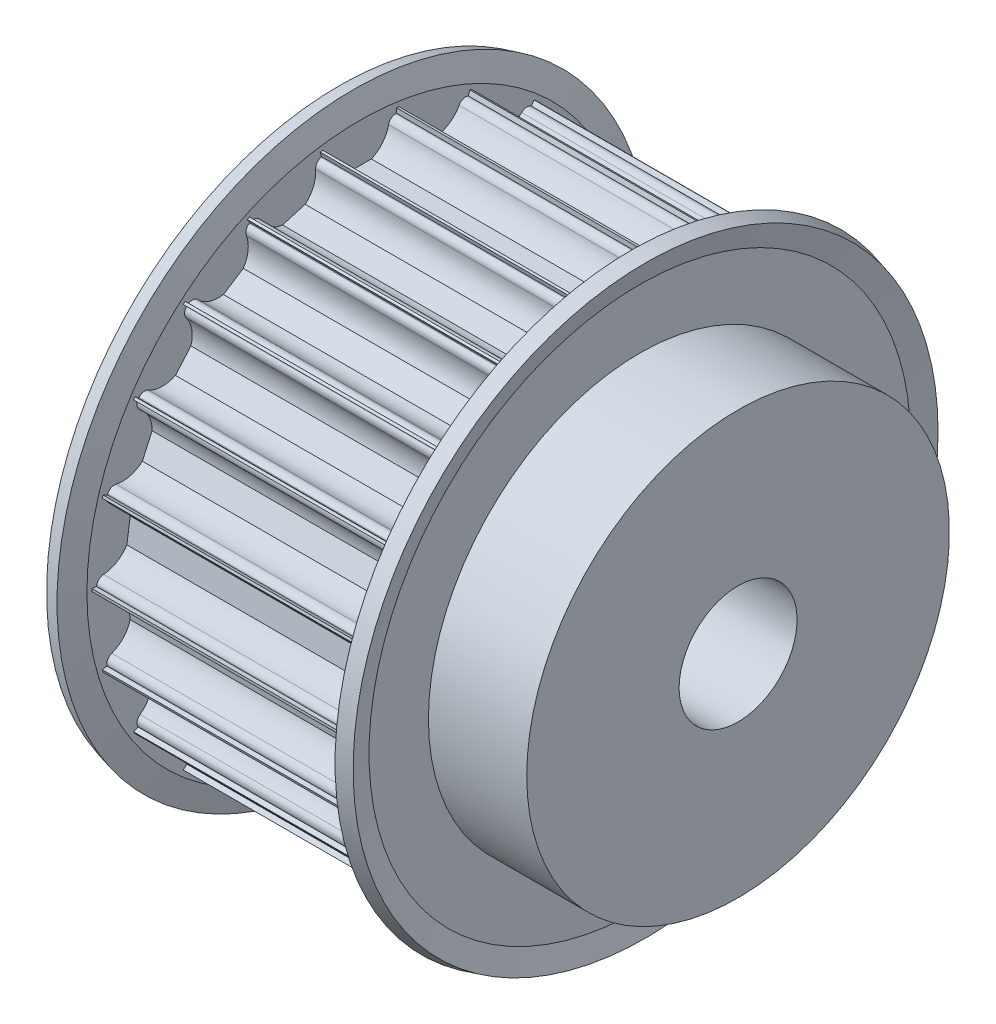
from build123d import *

# Parameters (mm, degrees)
CUT_EXTRUDE1_REACH = 57.544
CIRPATTERN1_COUNT  = 22


with BuildPart() as part:
    # Sketch1 → Revolve1 (revolve)
    with BuildSketch(Plane.XY, mode=Mode.PRIVATE) as revolve1_sk:
        Polygon((0, 6), (40, 6), (40, 21.5), (30, 21.5), (30, 27.25), (0, 27.25), align=None)
    revolve(revolve1_sk.sketch.rotate(Axis((-22.913888515, 0, 0), (1, 0, 0)), 90), axis=Axis((-22.913888515, 0, 0), (1, 0, 0)))

    # Sketch2 → Cut-Extrude1 (cut, up to next)
    with BuildSketch(Plane.ZY, mode=Mode.PRIVATE) as cut_extrude1_sk1:
        with BuildLine():
            Line((3.674234614, 26.5), (3.75, 26.5))
            Line((3.75, 26.5), (3.75, 28.5))
            Line((3.75, 28.5), (-3.75, 28.5))
            Line((-3.75, 28.5), (-3.75, 26.5))
            Line((-3.75, 26.5), (-3.674234614, 26.5))
            ThreePointArc((-3.674234614, 26.5), (-3.199892965, 26.330947502), (-2.939387691, 25.9))
            ThreePointArc((-2.939387691, 25.9), (-2.331759211, 24.612435701), (-1.198957881, 23.75))
            Line((-1.198957881, 23.75), (1.198957881, 23.75))
            ThreePointArc((1.198957881, 23.75), (2.331759211, 24.612435701), (2.939387691, 25.9))
            ThreePointArc((2.939387691, 25.9), (3.199892965, 26.330947502), (3.674234614, 26.5))
        make_face()
    cut_extrude1_tool1 = extrude(cut_extrude1_sk1.sketch, amount=-CUT_EXTRUDE1_REACH, mode=Mode.PRIVATE) & part.part
    cut_extrude1 = cut_extrude1_tool1.solids().sort_by_distance((0, 26.435169, 0))[0]
    add(cut_extrude1, mode=Mode.SUBTRACT)

    # CirPattern1: Cut-Extrude1 ×22 about axis
    cirpattern1_axis = Axis((0, 0, 0), (1, 0, 0))
    for i in range(1, CIRPATTERN1_COUNT):
        add(cut_extrude1.rotate(cirpattern1_axis, i * 360 / CIRPATTERN1_COUNT), mode=Mode.SUBTRACT)

    # Sketch3 → Revolve2 (revolve)
    with BuildSketch(Plane.XY, mode=Mode.PRIVATE) as revolve2_sk:
        Polygon((-0.591966801, 29.752510585), (0, 27.543260406), (0, 22.740739153), (1.5, 22.740739153), (1.5, 27.740739153), (0.856921938, 30.140739153), align=None)
        Polygon((30.591966801, 29.752510585), (29.143078062, 30.140739153), (28.5, 27.740739153), (28.5, 22.740739153), (30, 22.740739153), (30, 27.543260406), align=None)
    revolve(revolve2_sk.sketch.rotate(Axis((-22.913888515, 0, 0), (-1, 0, 0)), 90), axis=Axis((-22.913888515, 0, 0), (-1, 0, 0)))


solid = part.part
